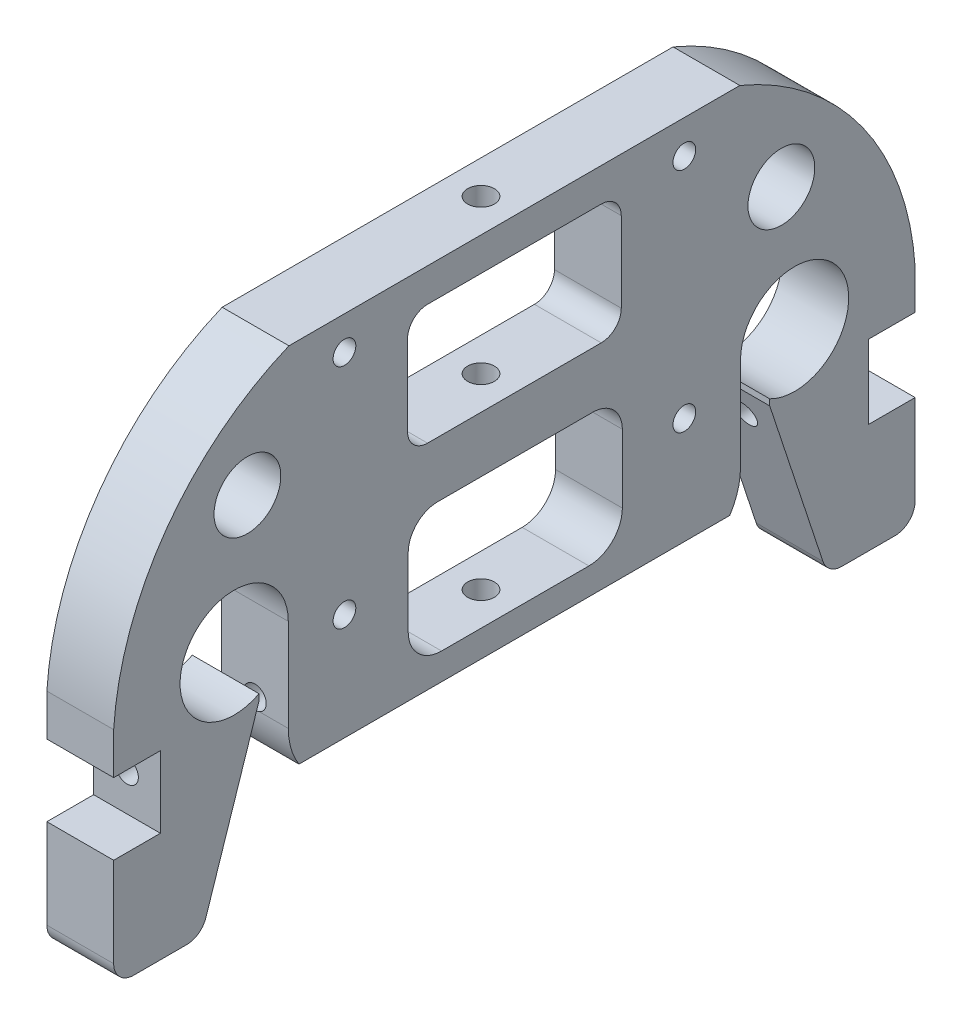
from build123d import *

# Parameters (mm, degrees)
SKETCH_1_R                = 1.7
EXTRUDE_1_DEPTH           = 10
CUT_EXTRUDE_1_DEPTH       = 67
SKETCH_3_W                = 3
SKETCH_3_H                = 5.795399196
SKETCH_3_H_2              = 5.79316294
CUT_EXTRUDE_2_DEPTH       = 8
SKETCH_5_R                = 1.7
CUT_EXTRUDE_3_DEPTH       = 31
CUT_EXTRUDE_START         = -31
SKETCH_6_R                = 1.7
CUT_EXTRUDE_4_DEPTH       = 31
SKETCH_9_R                = 5
CUT_EXTRUDE_6_DEPTH       = 10
CUT_EXTRUDE_7_DEPTH       = 10
CUT_EXTRUDE_9_DEPTH       = 10
FILLET_1_R                = 5
CUT_EXTRUDE_10_DEPTH      = 140.283882779
CUT_EXTRUDE_10_DEPTH_BACK = 10
SKETCH_12_W               = 10
SKETCH_12_H               = 11.048825586
CUT_EXTRUDE_11_DEPTH      = 7
SKETCH_14_W               = 10
SKETCH_14_H               = 10.712519762
CUT_EXTRUDE_12_DEPTH      = 7


with BuildPart() as part:
    # Эскиз1 → Бобышка-Вытянуть1 (new body)
    with BuildSketch(Plane(origin=(0, 0, 0), x_dir=(0, 0, -1), z_dir=(1, 0, 0))):
        with BuildLine():
            Line((3, 0), (10.95312335, 0))
            ThreePointArc((10.95312335, 0), (12.711116168, 0.569061652), (13.802171454, 2.060359164))
            Line((13.802171454, 2.060359164), (21.766885307, 26.20985548))
            Line((21.766885307, 26.20985548), (21.766885307, 27.126272908))
            ThreePointArc((21.766885307, 27.126272908), (11.12679914, 38.53238769), (26.145937625, 34.320931027))
            Line((26.145937625, 34.320931027), (26.145765698, 20.433139819))
            ThreePointArc((26.145765698, 20.433139819), (29.074654117, 13.361991979), (36.145765697, 10.433016021))
            Line((36.145765697, 10.433016021), (83.854234303, 10.433016021))
            ThreePointArc((83.854234303, 10.433016021), (90.925345883, 13.361991979), (93.854234302, 20.433139819))
            Line((93.854234302, 20.433139819), (93.854062375, 34.320931027))
            ThreePointArc((93.854062375, 34.320931027), (108.87320086, 38.53238769), (98.233114693, 27.126272908))
            Line((98.233114693, 27.126272908), (98.233114693, 26.20985548))
            Line((98.233114693, 26.20985548), (106.197828546, 2.060359164))
            ThreePointArc((106.197828546, 2.060359164), (107.288883832, 0.569061652), (109.04687665, 0))
            Line((109.04687665, 0), (117, 0))
            ThreePointArc((117, 0), (119.121320344, 0.878679656), (120, 3))
            Line((120, 3), (120, 67))
            ThreePointArc((120, 67), (119.121320344, 69.121320344), (117, 70))
            Line((117, 70), (3, 70))
            ThreePointArc((3, 70), (0.878679656, 69.121320344), (0, 67))
            Line((0, 67), (0, 3))
            ThreePointArc((0, 3), (0.878679656, 0.878679656), (3, 0))
        make_face()
        with Locations((34.556037496, 65)):
            Circle(SKETCH_1_R, mode=Mode.SUBTRACT)
        with Locations((34.556037496, 31)):
            Circle(SKETCH_1_R, mode=Mode.SUBTRACT)
        with Locations((85.443962504, 31)):
            Circle(SKETCH_1_R, mode=Mode.SUBTRACT)
        with Locations((85.443962504, 65)):
            Circle(SKETCH_1_R, mode=Mode.SUBTRACT)
        with BuildLine():
            Line((47, 65), (73, 65))
            ThreePointArc((73, 65), (75.121320344, 64.121320344), (76, 62))
            Line((76, 62), (76, 50))
            ThreePointArc((76, 50), (75.121320344, 47.878679656), (73, 47))
            Line((73, 47), (47, 47))
            ThreePointArc((47, 47), (44.878679656, 47.878679656), (44, 50))
            Line((44, 50), (44, 62))
            ThreePointArc((44, 62), (44.878679656, 64.121320344), (47, 65))
        make_face(mode=Mode.SUBTRACT)
        with BuildLine():
            Line((48.512942473, 38.640223749), (71.745561711, 38.640223749))
            ThreePointArc((71.745561711, 38.640223749), (76.161679417, 34.224106042), (71.745561711, 29.807988336))
            Line((71.745561711, 29.807988336), (48.512942473, 29.807988336))
            ThreePointArc((48.512942473, 29.807988336), (44.096824767, 34.224106042), (48.512942473, 38.640223749))
        make_face(mode=Mode.SUBTRACT)
    extrude(amount=EXTRUDE_1_DEPTH)

    # Эскиз2 → Вырез-Вытянуть1 (cut)
    with BuildSketch(Plane(origin=(0, 70, 0), x_dir=(1, 0, 0), z_dir=(0, 1, 0))):
        with BuildLine():
            ThreePointArc((7, 60), (6.414213562, 61.414213562), (5, 62))
            Line((5, 62), (5, 60))
            Line((5, 60), (7, 60))
        make_face()
        with BuildLine():
            Line((5, 60), (5, 62))
            ThreePointArc((5, 62), (3.585786438, 58.585786438), (7, 60))
            Line((7, 60), (5, 60))
        make_face()
    extrude(amount=-CUT_EXTRUDE_1_DEPTH, mode=Mode.SUBTRACT)

    # Эскиз3 → Вырез-Вытянуть2 (cut)
    with BuildSketch(Plane.ZY):
        with Locations((-89.477143784, 21.994873796)):
            Rectangle(SKETCH_3_W, SKETCH_3_H)
        Polygon((-62.852047751, 44.039665997), (-62.852047751, 41.024446306), (-57.047413287, 41.024446306), (-57.047413287, 44.039665997), (-59.949730519, 44.039665997), align=None)
        with Locations((-30.522856216, 21.995572621)):
            Rectangle(SKETCH_3_W, SKETCH_3_H_2)
    extrude(amount=-CUT_EXTRUDE_2_DEPTH, mode=Mode.SUBTRACT)

    # Эскиз5 → Вырез-Вытянуть3 (cut)
    with BuildSketch(Plane(origin=(0, 0, -120), x_dir=(-1, 0, 0), z_dir=(0, 0, -1))):
        with Locations(Location((-5, 22, 0), (0, 0, 292.826701249))):
            Circle(SKETCH_5_R)
    extrude(amount=-CUT_EXTRUDE_3_DEPTH, mode=Mode.SUBTRACT)

    # Эскиз6 → Вырез-Вытянуть4 (cut)
    with BuildSketch(Plane.XY.offset(CUT_EXTRUDE_START)):
        with Locations(Location((5, 22, 0), (0, 0, 247.173298751))):
            Circle(SKETCH_6_R)
    extrude(amount=CUT_EXTRUDE_4_DEPTH, mode=Mode.SUBTRACT)

    # Эскиз9 → Вырез-Вытянуть6 (cut)
    with BuildSketch(Plane.ZY):
        with Locations((-99.973969782, 53.749400687)):
            Circle(SKETCH_9_R)
        with Locations((-20.026030218, 53.749400687)):
            Circle(SKETCH_9_R)
    extrude(amount=-CUT_EXTRUDE_6_DEPTH, mode=Mode.SUBTRACT)

    # Эскиз7 → Вырез-Вытянуть7 (cut)
    with BuildSketch(Plane.ZY):
        with BuildLine():
            ThreePointArc((-71.745561711, 29.807988336), (-74.868228487, 31.101439266), (-76.161679417, 34.224106042))
            Line((-76.161679417, 34.224106042), (-76.161679417, 19))
            Line((-76.161679417, 19), (-44.096824767, 19))
            Line((-44.096824767, 19), (-44.096824767, 34.224106042))
            ThreePointArc((-44.096824767, 34.224106042), (-45.390275697, 31.101439266), (-48.512942473, 29.807988336))
            Line((-48.512942473, 29.807988336), (-71.745561711, 29.807988336))
        make_face()
    extrude(amount=-CUT_EXTRUDE_7_DEPTH, mode=Mode.SUBTRACT)

    # Эскиз10 → Вырез-Вытянуть9 (cut)
    with BuildSketch(Plane.ZY):
        Polygon((-26.82075904, 15), (-60.129252092, 15), (-92.249610227, 15), (-93.165688325, 15), (-93.165688325, 8.625567354), (-26.82075904, 8.625567354), align=None)
    extrude(amount=-CUT_EXTRUDE_9_DEPTH, mode=Mode.SUBTRACT)

    # Скругление1
    fillet_1_edges = [part.edges().sort_by_distance(p)[0] for p in [
        (5, 19, -44.096824767),
        (5, 19, -76.161679417),
    ]]
    fillet(fillet_1_edges, radius=FILLET_1_R)

    # Эскиз11 → Вырез-Вытянуть10 (cut, two sides: drawn at the far end of the back side and taken through both)
    with BuildSketch(Plane.ZY.offset(-CUT_EXTRUDE_10_DEPTH_BACK)):
        with BuildLine():
            ThreePointArc((-120.033991766, 32.77619879), (-112.271772588, 55.183752349), (-93.756122218, 70))
            Line((-93.756122218, 70), (-105.662508764, 70))
            Line((-105.662508764, 70), (-120.092282854, 70))
            Line((-120.092282854, 70), (-120.033991766, 32.77619879))
        make_face()
        with BuildLine():
            Line((0.033991766, 32.77619879), (0.092282854, 70))
            Line((0.092282854, 70), (-14.337491236, 70))
            Line((-14.337491236, 70), (-26.243877782, 70))
            ThreePointArc((-26.243877782, 70), (-7.728227412, 55.183752349), (0.033991766, 32.77619879))
        make_face()
    extrude(amount=CUT_EXTRUDE_10_DEPTH + CUT_EXTRUDE_10_DEPTH_BACK, mode=Mode.SUBTRACT)

    # Эскиз12 → Вырез-Вытянуть11 (cut)
    with BuildSketch(Plane(origin=(0, 0, -120), x_dir=(-1, 0, 0), z_dir=(0, 0, -1))):
        with Locations((-5, 21.938165939)):
            Rectangle(SKETCH_12_W, SKETCH_12_H)
    extrude(amount=-CUT_EXTRUDE_11_DEPTH, mode=Mode.SUBTRACT)

    # Эскиз14 → Вырез-Вытянуть12 (cut)
    with BuildSketch(Plane.XY):
        with Locations((5, 21.770013027)):
            Rectangle(SKETCH_14_W, SKETCH_14_H)
    extrude(amount=-CUT_EXTRUDE_12_DEPTH, mode=Mode.SUBTRACT)


solid = part.part
